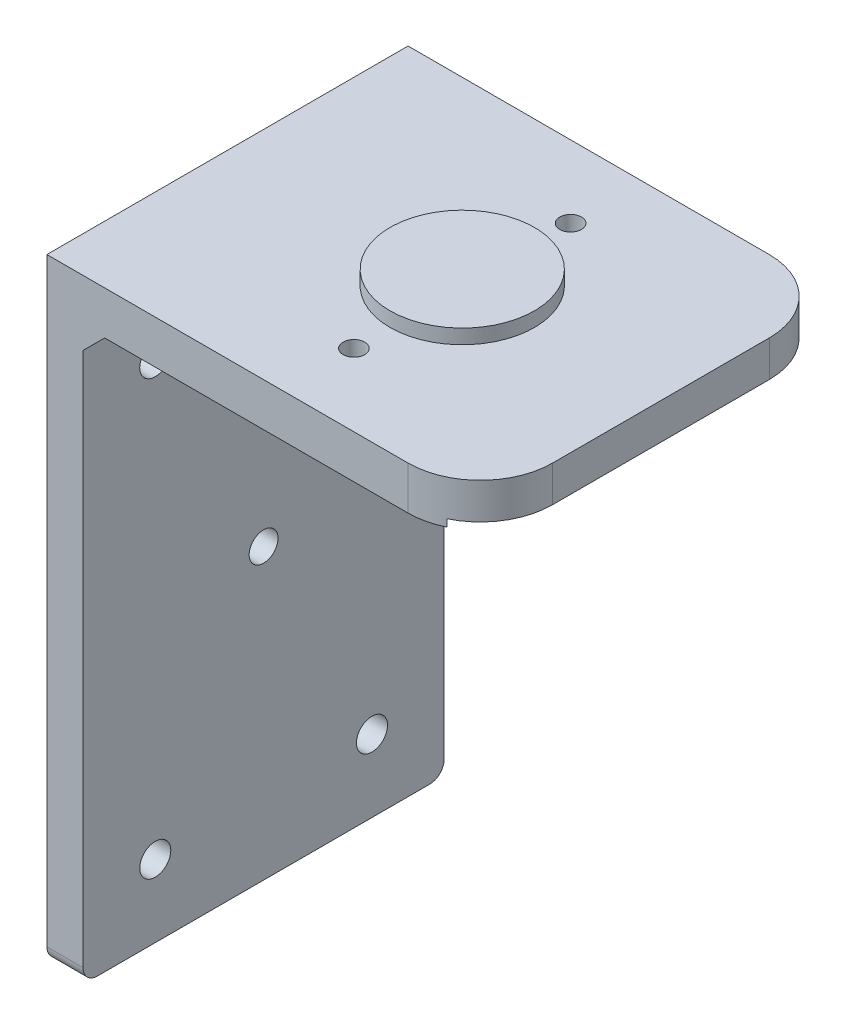
from build123d import *

# Parameters (mm, degrees)
SKETCH_1_R          = 1.5
SKETCH_1_R_2        = 10
EXTRUDE_2_DEPTH     = 5
SKETCH_3_W          = 5
SKETCH_3_H          = 50
EXTRUDE_4_DEPTH     = 80
SKETCH_4_R          = 2
CUT_EXTRUDE_1_DEPTH = 40
SKETCH_7_R          = 2.15
CUT_EXTRUDE_2_DEPTH = 120.337479599
CUT_EXTRUDE_3_DEPTH = 10
FILLET_2_R          = 2
SKETCH_13_W         = 50
SKETCH_13_H         = 4
EXTRUDE_5_DEPTH     = 4
CUT_EXTRUDE_4_DEPTH = 123.259965047
SKETCH_16_W         = 1
SKETCH_16_H         = 1
EXTRUDE_6_DEPTH     = 1
SKETCH_17_W         = 1
SKETCH_17_H         = 1
EXTRUDE_7_DEPTH     = 55
SKETCH_19_W         = 1
SKETCH_19_H         = 1
EXTRUDE_8_DEPTH     = 1
SKETCH_20_W         = 1
SKETCH_20_H         = 1
EXTRUDE_9_DEPTH     = 55
FILLET_3_R          = 10
SKETCH_21_R         = 10
EXTRUDE_10_DEPTH    = 2


with BuildPart() as part:
    # 草图1 → 凸台-拉伸2 (new body)
    with BuildSketch(Plane(origin=(0, 0, 0), x_dir=(1, 0, 0), z_dir=(0, 1, 0))):
        with BuildLine():
            Line((-77.765667575, 2.920980926), (-12.765667575, 2.920980926))
            ThreePointArc((-12.765667575, 2.920980926), (-2.159065857, -1.472417356), (2.234332425, -12.079019074))
            Line((2.234332425, -12.079019074), (2.234332425, -32.079019074))
            ThreePointArc((2.234332425, -32.079019074), (-2.159065857, -42.685620791), (-12.765667575, -47.079019074))
            Line((-12.765667575, -47.079019074), (-77.765667575, -47.079019074))
            Line((-77.765667575, -47.079019074), (-77.765667575, 2.920980926))
        make_face()
        with Locations(Location((-45.265667575, -37.079019074, 0), (0, 0, 270))):
            Circle(SKETCH_1_R, mode=Mode.SUBTRACT)
        with Locations(Location((-45.265667575, -22.079019074, 0), (0, 0, 270))):
            Circle(SKETCH_1_R_2, mode=Mode.SUBTRACT)
        with Locations(Location((-45.265667575, -7.079019074, 0), (0, 0, 270))):
            Circle(SKETCH_1_R, mode=Mode.SUBTRACT)
    extrude(amount=EXTRUDE_2_DEPTH)

    # 草图3 → 凸台-拉伸4 (add)
    with BuildSketch(Plane.XZ):
        with Locations((-75.265667575, 22.079019074)):
            Rectangle(SKETCH_3_W, SKETCH_3_H)
    extrude(amount=EXTRUDE_4_DEPTH)

    # 草图4 → 切除-拉伸1 (cut)
    with BuildSketch(Plane(origin=(-72.765667575, 0, 0), x_dir=(0, 0, -1), z_dir=(1, 0, 0))):
        with Locations((-22.079019074, -40)):
            Circle(SKETCH_4_R)
    extrude(amount=-CUT_EXTRUDE_1_DEPTH, mode=Mode.SUBTRACT)

    # 草图7 → 切除-拉伸2 (cut, through all)
    with BuildSketch(Plane(origin=(-72.765667575, 0, 0), x_dir=(0, 0, -1), z_dir=(1, 0, 0))):
        with Locations((-7.079019074, -10)):
            Circle(SKETCH_7_R)
        with Locations(Location((-37.079019074, -10, 0), (0, 0, 180))):
            Circle(SKETCH_7_R)
        with Locations(Location((-7.079019074, -70, 0), (0, 0, 180))):
            Circle(SKETCH_7_R)
        with Locations((-37.079019074, -70)):
            Circle(SKETCH_7_R)
    extrude(amount=-CUT_EXTRUDE_2_DEPTH, mode=Mode.SUBTRACT)

    # 草图12 → 切除-拉伸3 (cut)
    with BuildSketch(Plane.XZ):
        with BuildLine():
            Line((-17.765667575, 47.079019074), (-17.765667575, 22.079019074))
            Line((-17.765667575, 22.079019074), (-17.765667575, -2.920980926))
            Line((-17.765667575, -2.920980926), (-12.765667575, -2.920980926))
            ThreePointArc((-12.765667575, -2.920980926), (-2.159065857, 1.472417356), (2.234332425, 12.079019074))
            Line((2.234332425, 12.079019074), (2.234332425, 32.079019074))
            ThreePointArc((2.234332425, 32.079019074), (-2.159065857, 42.685620791), (-12.765667575, 47.079019074))
            Line((-12.765667575, 47.079019074), (-17.765667575, 47.079019074))
        make_face()
    extrude(amount=-CUT_EXTRUDE_3_DEPTH, mode=Mode.SUBTRACT)

    # 圆角2
    fillet_2_edges = [part.edges().sort_by_distance(p)[0] for p in [
        (-75.265667575, -80, -2.920980926),
        (-75.265667575, -80, 47.079019074),
    ]]
    fillet(fillet_2_edges, radius=FILLET_2_R)

    # 草图13 → 凸台-拉伸5 (add)
    with BuildSketch(Plane(origin=(-72.765667575, 0, 0), x_dir=(0, 0, -1), z_dir=(1, 0, 0))):
        with Locations((-22.079019074, -2)):
            Rectangle(SKETCH_13_W, SKETCH_13_H)
    extrude(amount=EXTRUDE_5_DEPTH)

    # 草图14 → 切除-拉伸4 (cut, through all)
    with BuildSketch(Plane(origin=(0, 0, -2.920980926), x_dir=(-1, 0, 0), z_dir=(0, 0, -1))):
        Polygon((68.765667575, 0), (72.765667575, -4), (68.765667575, -4), align=None)
    extrude(amount=-CUT_EXTRUDE_4_DEPTH, mode=Mode.SUBTRACT)

    # 草图16 → 凸台-拉伸6 (add)
    with BuildSketch(Plane.XZ):
        with Locations((-18.265667575, -2.420980926)):
            Rectangle(SKETCH_16_W, SKETCH_16_H)
    extrude(amount=EXTRUDE_6_DEPTH)

    # 草图17 → 凸台-拉伸7 (add)
    with BuildSketch(Plane.ZY.offset(18.765667575)):
        with Locations((-2.420980926, -0.5)):
            Rectangle(SKETCH_17_W, SKETCH_17_H)
    extrude(amount=EXTRUDE_7_DEPTH)

    # 草图19 → 凸台-拉伸8 (add)
    with BuildSketch(Plane.XZ):
        with Locations((-18.265667575, 46.579019074)):
            Rectangle(SKETCH_19_W, SKETCH_19_H)
    extrude(amount=EXTRUDE_8_DEPTH)

    # 草图20 → 凸台-拉伸9 (add)
    with BuildSketch(Plane.ZY.offset(18.765667575)):
        with Locations((46.579019074, -0.5)):
            Rectangle(SKETCH_20_W, SKETCH_20_H)
    extrude(amount=EXTRUDE_9_DEPTH)

    # 圆角3
    fillet_3_edges = [part.edges().sort_by_distance(p)[0] for p in [
        (-17.765667575, 2, -2.920980926),
        (-17.765667575, 2, 47.079019074),
    ]]
    fillet(fillet_3_edges, radius=FILLET_3_R)


with BuildPart() as body_2:
    # 草图21 → 凸台-拉伸10 (new body)
    with BuildSketch(Plane(origin=(0, 5, 0), x_dir=(1, 0, 0), z_dir=(0, 1, 0))):
        with Locations(Location((-45.265667575, -22.079019074, 0), (0, 0, 270))):
            Circle(SKETCH_21_R)
    extrude(amount=EXTRUDE_10_DEPTH)


solid = Compound([part.part, body_2.part])
